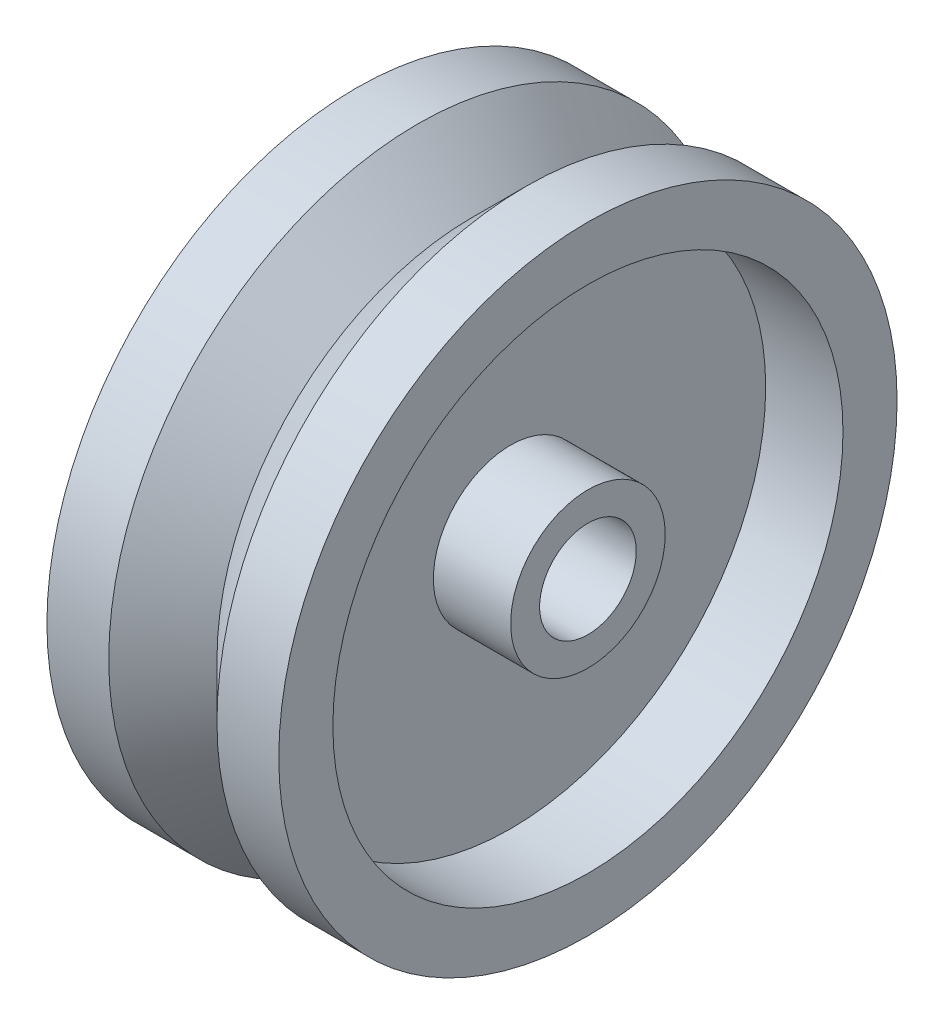
from build123d import *

# Parameters (mm, degrees)
SKETCH1_R           = 20
SKETCH1_R_2         = 3.125
BOSS_EXTRUDE1_DEPTH = 7.5
SKETCH2_R           = 16.5
SKETCH2_R_2         = 5
CUT_EXTRUDE1_DEPTH  = 5


with BuildPart() as part:
    # Sketch1 → Boss-Extrude1 (new, symmetric)
    with BuildSketch(Plane(origin=(0, 0, 0), x_dir=(0, 0, -1), z_dir=(1, 0, 0))):
        Circle(SKETCH1_R)
        Circle(SKETCH1_R_2, mode=Mode.SUBTRACT)
    extrude(amount=BOSS_EXTRUDE1_DEPTH, both=True)

    # Sketch2 → Cut-Extrude1 (cut)
    with BuildSketch(Plane(origin=(7.5, 0, 0), x_dir=(0, 0, -1), z_dir=(1, 0, 0))):
        Circle(SKETCH2_R)
        Circle(SKETCH2_R_2, mode=Mode.SUBTRACT)
    cut_extrude1 = extrude(amount=-CUT_EXTRUDE1_DEPTH, mode=Mode.SUBTRACT)

    # Mirror1: Cut-Extrude1 across plane
    add(cut_extrude1.mirror(Plane(origin=(0, 0, 0), x_dir=(0, 0, 1), z_dir=(1, 0, 0))), mode=Mode.SUBTRACT)

    # Sketch3 → Cut-Revolve1 (revolve, cut)
    with BuildSketch(Plane.XY, mode=Mode.PRIVATE) as cut_revolve1_sk:
        Polygon((-3.5, 20), (3.5, 20), (0, 16.5), align=None)
    revolve(cut_revolve1_sk.sketch.rotate(Axis((0, 0, 0), (1, 0, 0)), 90), axis=Axis((0, 0, 0), (1, 0, 0)), mode=Mode.SUBTRACT)


solid = part.part
